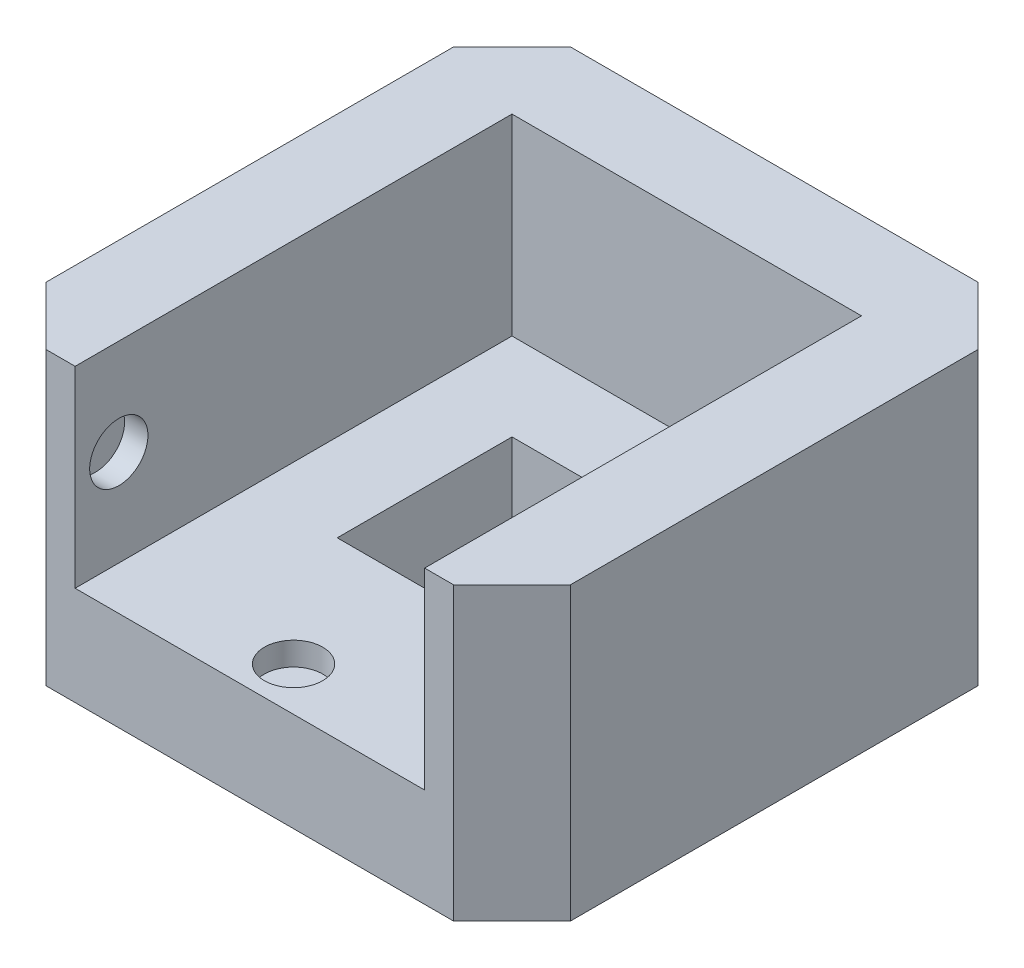
from build123d import *

# Parameters (mm, degrees)
SKETCH1_W           = 114.3
SKETCH1_H           = 114.3
SKETCH1_W_2         = 38.1
SKETCH1_H_2         = 38.1
BOSS_EXTRUDE1_DEPTH = 76.2
SKETCH3_W           = 76.2
SKETCH3_H           = 76.2
CUT_EXTRUDE2_DEPTH  = 54.61
SKETCH5_W           = 114.3
SKETCH5_H           = 114.3
SKETCH5_W_2         = 76.2
SKETCH5_H_2         = 76.2
CUT_EXTRUDE3_DEPTH  = 12.7
CHAMFER1_SIZE       = 12.7
CUT_EXTRUDE4_REACH  = 144.699
SKETCH6_W           = 76.2
SKETCH6_H           = 41.91
SKETCH7_R           = 6.35
CUT_EXTRUDE5_DEPTH  = 5.08
SKETCH9_R           = 6.35
CUT_EXTRUDE6_DEPTH  = 5.08
CUT_EXTRUDE7_START  = -5.08
SKETCH8_R           = 6.35
CUT_EXTRUDE7_DEPTH  = 5.08


with BuildPart() as part:
    # Sketch1 → Boss-Extrude1 (new body)
    with BuildSketch(Plane(origin=(0, 0, 0), x_dir=(1, 0, 0), z_dir=(0, 1, 0))):
        Rectangle(SKETCH1_W, SKETCH1_H)
        Rectangle(SKETCH1_W_2, SKETCH1_H_2, mode=Mode.SUBTRACT)
    extrude(amount=BOSS_EXTRUDE1_DEPTH)

    # Sketch3 → Cut-Extrude2 (cut)
    with BuildSketch(Plane(origin=(0, 76.2, 0), x_dir=(1, 0, 0), z_dir=(0, 1, 0))):
        Rectangle(SKETCH3_W, SKETCH3_H)
    extrude(amount=-CUT_EXTRUDE2_DEPTH, mode=Mode.SUBTRACT)

    # Sketch5 → Cut-Extrude3 (cut)
    with BuildSketch(Plane(origin=(0, 76.2, 0), x_dir=(1, 0, 0), z_dir=(0, 1, 0))):
        Rectangle(SKETCH5_W, SKETCH5_H)
        Rectangle(SKETCH5_W_2, SKETCH5_H_2, mode=Mode.SUBTRACT)
    extrude(amount=-CUT_EXTRUDE3_DEPTH, mode=Mode.SUBTRACT)

    # Chamfer1
    chamfer1_edges = [part.edges().sort_by_distance(p)[0] for p in [
        (57.15, 31.75, 57.15),
        (-57.15, 31.75, 57.15),
        (-57.15, 31.75, -57.15),
        (57.15, 31.75, -57.15),
    ]]
    chamfer(chamfer1_edges, length=CHAMFER1_SIZE)

    # Sketch6 → Cut-Extrude4 (cut, up to next)
    with BuildSketch(Plane.XY.offset(57.15), mode=Mode.PRIVATE) as cut_extrude4_sk1:
        with Locations((0, 42.545)):
            Rectangle(SKETCH6_W, SKETCH6_H)
    cut_extrude4_tool1 = extrude(cut_extrude4_sk1.sketch, amount=-CUT_EXTRUDE4_REACH, mode=Mode.PRIVATE) & part.part
    add(cut_extrude4_tool1.solids().sort_by_distance((0, 42.545, 57.15))[0], mode=Mode.SUBTRACT)

    # Sketch7 → Cut-Extrude5 (cut)
    with BuildSketch(Plane(origin=(0, 21.59, 0), x_dir=(1, 0, 0), z_dir=(0, 1, 0))):
        with Locations(Location((0, -47.625, 0), (0, 0, 270))):
            Circle(SKETCH7_R)
    extrude(amount=-CUT_EXTRUDE5_DEPTH, mode=Mode.SUBTRACT)

    # Sketch9 → Cut-Extrude6 (cut)
    with BuildSketch(Plane.ZY.offset(-38.1)):
        with Locations((47.625, 42.545)):
            Circle(SKETCH9_R)
    extrude(amount=-CUT_EXTRUDE6_DEPTH, mode=Mode.SUBTRACT)

    # Sketch8 → Cut-Extrude7 (cut)
    with BuildSketch(Plane(origin=(-38.1, 0, 0), x_dir=(0, 0, -1), z_dir=(1, 0, 0)).offset(CUT_EXTRUDE7_START)):
        with Locations(Location((-47.625, 42.545, 0), (0, 0, 180))):
            Circle(SKETCH8_R)
    extrude(amount=CUT_EXTRUDE7_DEPTH, mode=Mode.SUBTRACT)


solid = part.part
